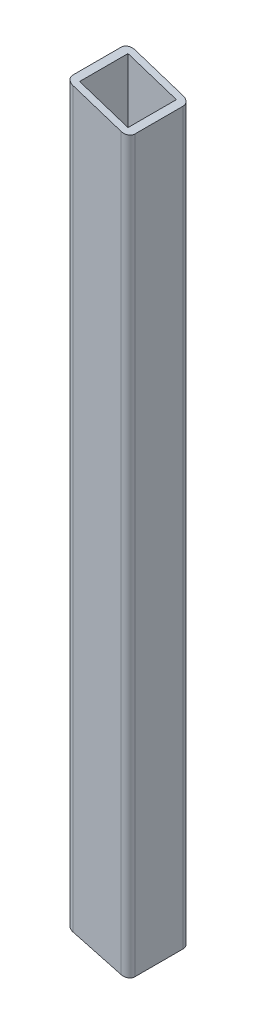
from build123d import *

# Parameters (mm, degrees)
BOSS_EXTRUDE1_DEPTH     = 310
SKETCH3_W               = 20
SKETCH3_H               = 20
CUT_EXTRUDE1_DEPTH      = 1040.5
CUT_EXTRUDE2_DEPTH      = 312.889724101
CUT_EXTRUDE2_DEPTH_BACK = 312.889724101
CUT_EXTRUDE3_DEPTH      = 312.889724101
CUT_EXTRUDE3_DEPTH_BACK = 312.889724101


with BuildPart() as part:
    # Sketch1 → Boss-Extrude1 (new body)
    with BuildSketch(Plane(origin=(0, 0, 0), x_dir=(1, 0, 0), z_dir=(0, 1, 0))):
        with BuildLine():
            Line((2.8, 0), (22.8, 0))
            ThreePointArc((22.8, 0), (24.779898987, -0.820101013), (25.6, -2.8))
            Line((25.6, -2.8), (25.6, -22.8))
            ThreePointArc((25.6, -22.8), (24.779898987, -24.779898987), (22.8, -25.6))
            Line((22.8, -25.6), (2.8, -25.6))
            ThreePointArc((2.8, -25.6), (0.820101013, -24.779898987), (0, -22.8))
            Line((0, -22.8), (0, -2.8))
            ThreePointArc((0, -2.8), (0.820101013, -0.820101013), (2.8, 0))
        make_face()
    extrude(amount=BOSS_EXTRUDE1_DEPTH)

    # Sketch3 → Cut-Extrude1 (cut)
    with BuildSketch(Plane(origin=(0, 0, 0), x_dir=(-1, 0, 0), z_dir=(0, -1, 0))):
        with Locations((-12.8, -12.8)):
            Rectangle(SKETCH3_W, SKETCH3_H)
    extrude(amount=-CUT_EXTRUDE1_DEPTH, mode=Mode.SUBTRACT)

    # Sketch4 → Cut-Extrude2 (cut, two sides: drawn at the far end of the back side and taken through both)
    with BuildSketch(Plane.XY.offset(22.8).offset(-CUT_EXTRUDE2_DEPTH_BACK)):
        Polygon((-601.172783894, 505.332878326), (0, 310), (25.6, 301.682055776), (626.772783894, 106.34917745), (1017.438540547, 1308.694745238), (-210.507027241, 1707.678446114), align=None)
    extrude(amount=CUT_EXTRUDE2_DEPTH + CUT_EXTRUDE2_DEPTH_BACK, mode=Mode.SUBTRACT)

    # Sketch5 → Cut-Extrude3 (cut, two sides: drawn at the far end of the back side and taken through both)
    with BuildSketch(Plane.XY.offset(22.8).offset(-CUT_EXTRUDE3_DEPTH_BACK)):
        Polygon((636.17183046, -163.602228893), (25.6, 0), (0, 6.859499326), (-610.57183046, 170.461728219), (-937.776288246, -1050.681932701), (308.967372674, -1384.745889813), align=None)
    extrude(amount=CUT_EXTRUDE3_DEPTH + CUT_EXTRUDE3_DEPTH_BACK, mode=Mode.SUBTRACT)


solid = part.part
